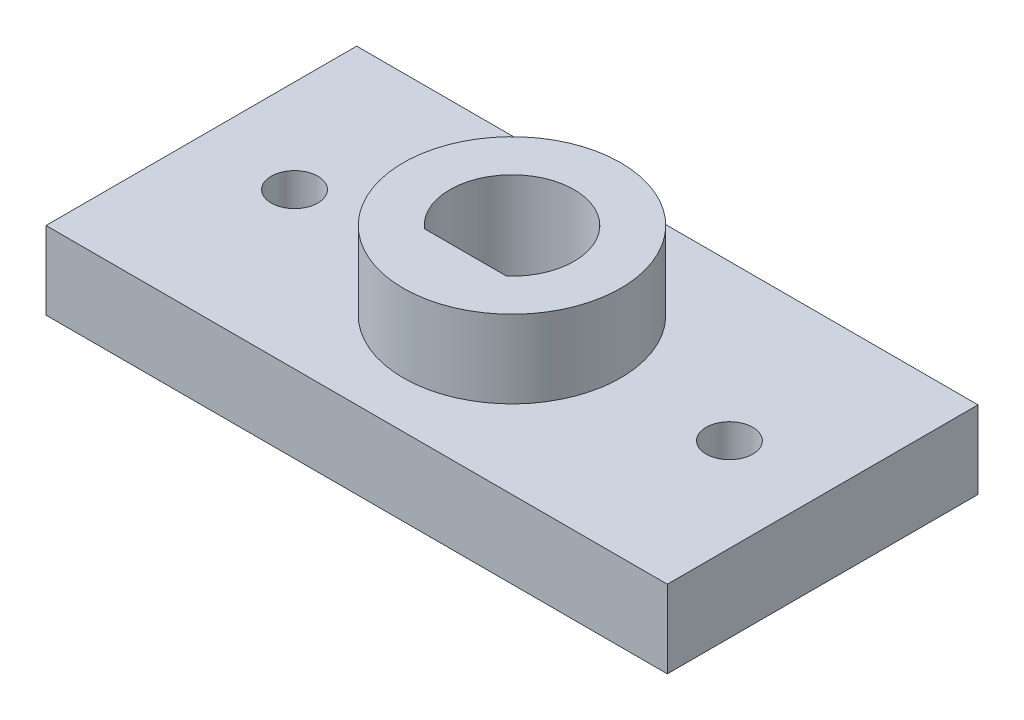
from build123d import *

# Parameters (mm, degrees)
SKETCH1_W           = 40
SKETCH1_H           = 20
SKETCH1_R           = 1.5
BOSS_EXTRUDE1_DEPTH = 5
SKETCH2_R           = 7
BOSS_EXTRUDE2_DEPTH = 5


with BuildPart() as part:
    # Sketch1 → Boss-Extrude1 (new body)
    with BuildSketch(Plane(origin=(0, 0, 0), x_dir=(1, 0, 0), z_dir=(0, 1, 0))):
        Rectangle(SKETCH1_W, SKETCH1_H)
        with Locations(Location((14, 0, 0), (0, 0, 270))):
            Circle(SKETCH1_R, mode=Mode.SUBTRACT)
        with Locations(Location((-14, 0, 0), (0, 0, 270))):
            Circle(SKETCH1_R, mode=Mode.SUBTRACT)
        with BuildLine():
            Line((-2.645751311, -3), (2.645751311, -3))
            ThreePointArc((2.645751311, -3), (0, 4), (-2.645751311, -3))
        make_face(mode=Mode.SUBTRACT)
    extrude(amount=BOSS_EXTRUDE1_DEPTH)

    # Sketch2 → Boss-Extrude2 (add)
    with BuildSketch(Plane(origin=(0, 5, 0), x_dir=(1, 0, 0), z_dir=(0, 1, 0))):
        with Locations(Location((0, 0, 0), (0, 0, 270))):
            Circle(SKETCH2_R)
        with BuildLine():
            ThreePointArc((-2.645751311, -3), (0, 4), (2.645751311, -3))
            Line((2.645751311, -3), (-2.645751311, -3))
        make_face(mode=Mode.SUBTRACT)
    extrude(amount=BOSS_EXTRUDE2_DEPTH)


solid = part.part
